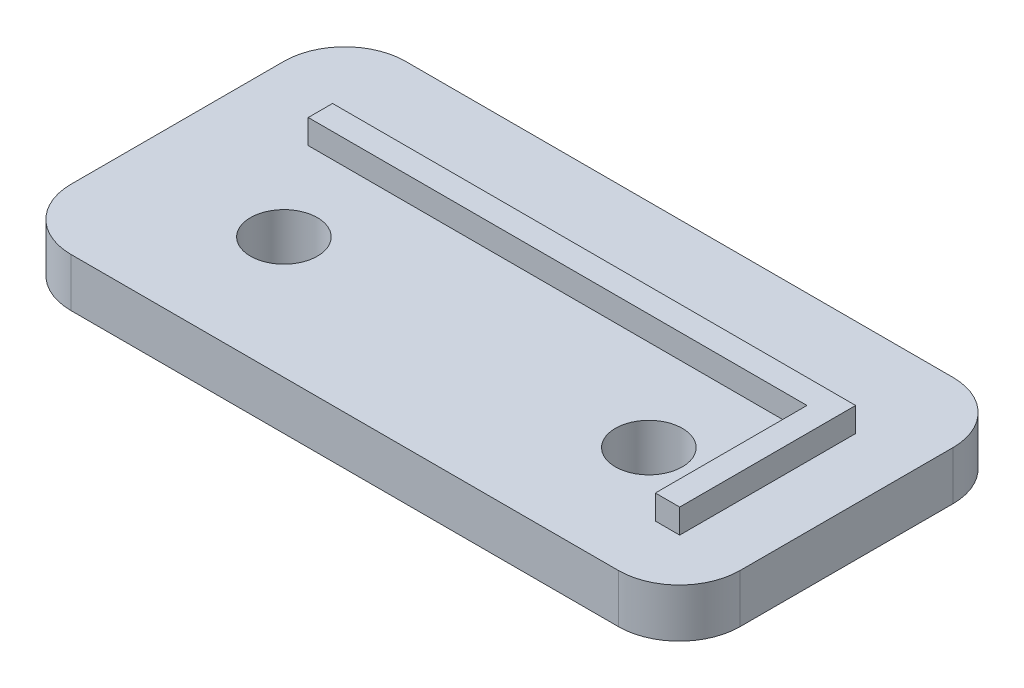
from build123d import *

# Parameters (mm, degrees)
SKETCH_1_W          = 55
SKETCH_1_H          = 27.5
EXTRUDE_1_DEPTH     = 4
SKETCH_2_R          = 2.75
CUT_EXTRUDE_1_DEPTH = 62.621830547
FILLET_1_R          = 5
SKETCH_4_W          = 20.5
SKETCH_4_H          = 2
SKETCH_4_W_2        = 2
SKETCH_4_H_2        = 12.464207651
EXTRUDE_6_DEPTH     = 2


with BuildPart() as part:
    # 草图1 → 凸台-拉伸1 (new body)
    with BuildSketch(Plane(origin=(0, 0, 0), x_dir=(1, 0, 0), z_dir=(0, 1, 0))):
        with Locations((-27.5, 13.75)):
            Rectangle(SKETCH_1_W, SKETCH_1_H)
    extrude(amount=EXTRUDE_1_DEPTH)

    # 草图2 → 切除-拉伸1 (cut, through all)
    with BuildSketch(Plane(origin=(0, 4, 0), x_dir=(1, 0, 0), z_dir=(0, 1, 0))):
        with Locations(Location((-42.5, 10, 0), (0, 0, 270))):
            Circle(SKETCH_2_R)
        with Locations(Location((-12.5, 10, 0), (0, 0, 270))):
            Circle(SKETCH_2_R)
    extrude(amount=-CUT_EXTRUDE_1_DEPTH, mode=Mode.SUBTRACT)

    # 圆角1
    fillet_1_edges = [part.edges().sort_by_distance(p)[0] for p in [
        (0, 2, 0),
        (-55, 2, 0),
        (-55, 2, -27.5),
        (0, 2, -27.5),
    ]]
    fillet(fillet_1_edges, radius=FILLET_1_R)

    # 草图4 → 凸台-拉伸6 (add)
    with BuildSketch(Plane(origin=(0, 4, 0), x_dir=(1, 0, 0), z_dir=(0, 1, 0))):
        with Locations((-17.25, 18.5)):
            Rectangle(SKETCH_4_W, SKETCH_4_H)
        with Locations((-6, 18.5)):
            Rectangle(SKETCH_4_W_2, SKETCH_4_H)
        with Locations((-6, 11.267896175)):
            Rectangle(SKETCH_4_W_2, SKETCH_4_H_2)
        with Locations((-37.75, 18.5)):
            Rectangle(SKETCH_4_W, SKETCH_4_H)
    extrude(amount=EXTRUDE_6_DEPTH)


solid = part.part
